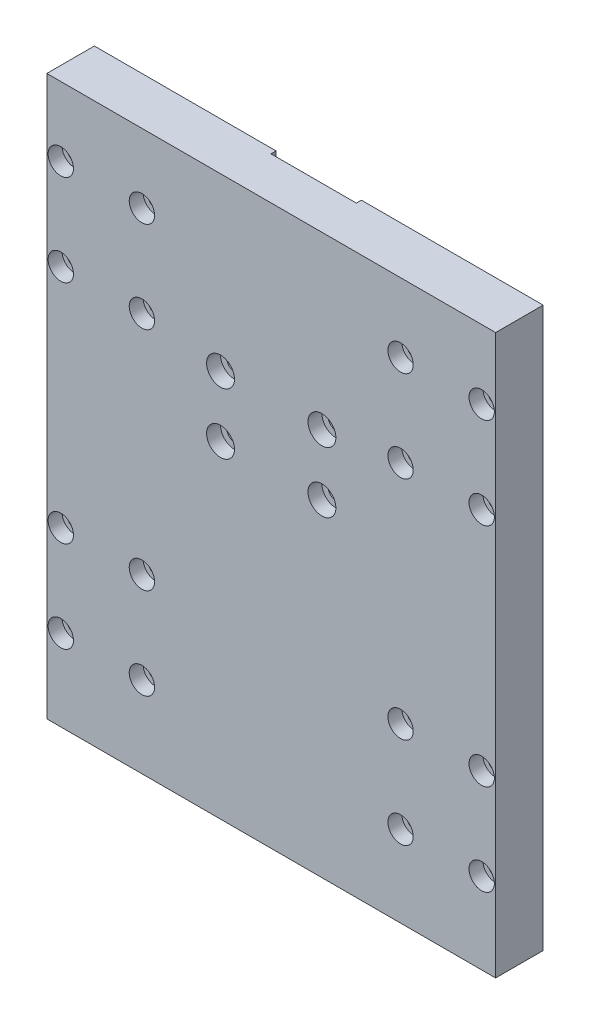
from build123d import *

# Parameters (mm, degrees)
SKETCH1_R                               = 3
BOSS_EXTRUDE1_DEPTH                     = 18.75
SKETCH2_R                               = 5
CUT_EXTRUDE3_DEPTH                      = 5.5
CBORE_FOR_M5_HEX_HEAD_BOLT1_D           = 6
CBORE_FOR_M5_HEX_HEAD_BOLT1_CBORE_D     = 11
CBORE_FOR_M5_HEX_HEAD_BOLT1_CBORE_DEPTH = 5.5
CUT_EXTRUDE4_DEPTH                      = 40
CUT_EXTRUDE5_DEPTH                      = 4


with BuildPart() as part:
    # Sketch1 → Boss-Extrude1 (new body)
    with BuildSketch(Plane.XY):
        Polygon((88.518625365, 66.433253323), (-88.518625365, 66.433253323), (-88.518625365, 46.433253323), (-88.518625365, -4.066746677), (-88.518625365, -154.066746677), (88.518625365, -154.066746677), (88.518625365, -4.066746677), (88.518625365, 46.433253323), align=None)
        with Locations((83.018625365, 39.183253323)):
            Circle(SKETCH1_R, mode=Mode.SUBTRACT)
        with Locations((51.018625365, 39.183253323)):
            Circle(SKETCH1_R, mode=Mode.SUBTRACT)
        with Locations((83.018625365, 3.183253323)):
            Circle(SKETCH1_R, mode=Mode.SUBTRACT)
        with Locations((51.018625365, 3.183253323)):
            Circle(SKETCH1_R, mode=Mode.SUBTRACT)
        with Locations((83.018625365, -86.016746677)):
            Circle(SKETCH1_R, mode=Mode.SUBTRACT)
        with Locations((51.018625365, -86.016746677)):
            Circle(SKETCH1_R, mode=Mode.SUBTRACT)
        with Locations((51.018625365, -122.016746677)):
            Circle(SKETCH1_R, mode=Mode.SUBTRACT)
        with Locations((83.018625365, -122.016746677)):
            Circle(SKETCH1_R, mode=Mode.SUBTRACT)
        with Locations(Location((-83.018625365, -122.016746677, 0), (0, 0, 180))):
            Circle(SKETCH1_R, mode=Mode.SUBTRACT)
        with Locations(Location((-51.018625365, -122.016746677, 0), (0, 0, 180))):
            Circle(SKETCH1_R, mode=Mode.SUBTRACT)
        with Locations(Location((-51.018625365, -86.016746677, 0), (0, 0, 180))):
            Circle(SKETCH1_R, mode=Mode.SUBTRACT)
        with Locations(Location((-83.018625365, -86.016746677, 0), (0, 0, 180))):
            Circle(SKETCH1_R, mode=Mode.SUBTRACT)
        with Locations(Location((-51.018625365, 3.183253323, 0), (0, 0, 180))):
            Circle(SKETCH1_R, mode=Mode.SUBTRACT)
        with Locations(Location((-83.018625365, 3.183253323, 0), (0, 0, 180))):
            Circle(SKETCH1_R, mode=Mode.SUBTRACT)
        with Locations(Location((-51.018625365, 39.183253323, 0), (0, 0, 180))):
            Circle(SKETCH1_R, mode=Mode.SUBTRACT)
        with Locations(Location((-83.018625365, 39.183253323, 0), (0, 0, 180))):
            Circle(SKETCH1_R, mode=Mode.SUBTRACT)
    extrude(amount=BOSS_EXTRUDE1_DEPTH)

    # Sketch2 → Cut-Extrude3 (cut)
    with BuildSketch(Plane.XY.offset(18.75)):
        with Locations((-51.018625365, 39.183253323)):
            Circle(SKETCH2_R)
        with Locations((-83.018625365, 39.183253323)):
            Circle(SKETCH2_R)
        with Locations((-83.018625365, 3.183253323)):
            Circle(SKETCH2_R)
        with Locations((51.018625365, 39.183253323)):
            Circle(SKETCH2_R)
        with Locations((83.018625365, 39.183253323)):
            Circle(SKETCH2_R)
        with Locations((83.018625365, 3.183253323)):
            Circle(SKETCH2_R)
        with Locations((51.018625365, 3.183253323)):
            Circle(SKETCH2_R)
        with Locations((-51.018625365, 3.183253323)):
            Circle(SKETCH2_R)
        with Locations((-83.018625365, -86.016746677)):
            Circle(SKETCH2_R)
        with Locations((-51.018625365, -86.016746677)):
            Circle(SKETCH2_R)
        with Locations((-51.018625365, -122.016746677)):
            Circle(SKETCH2_R)
        with Locations((-83.018625365, -122.016746677)):
            Circle(SKETCH2_R)
        with Locations((51.018625365, -122.016746677)):
            Circle(SKETCH2_R)
        with Locations((51.018625365, -86.016746677)):
            Circle(SKETCH2_R)
        with Locations((83.018625365, -86.016746677)):
            Circle(SKETCH2_R)
        with Locations((83.018625365, -122.016746677)):
            Circle(SKETCH2_R)
    extrude(amount=-CUT_EXTRUDE3_DEPTH, mode=Mode.SUBTRACT)

    # CBORE for M5 Hex Head Bolt1 (through all)
    with Locations(Plane.XY.offset(18.75)):
        with Locations((-20, -1), (20, -1), (-20, -25), (20, -25)):
            CounterBoreHole(CBORE_FOR_M5_HEX_HEAD_BOLT1_D / 2, CBORE_FOR_M5_HEX_HEAD_BOLT1_CBORE_D / 2, CBORE_FOR_M5_HEX_HEAD_BOLT1_CBORE_DEPTH)

    # Sketch7 → Cut-Extrude4 (cut)
    with BuildSketch(Plane(origin=(0, 66.433253323, 0), x_dir=(1, 0, 0), z_dir=(0, 1, 0))):
        Polygon((-14.828427125, -2), (-16.828427125, -2), (-16.828427125, 0), (16.828427125, 0), (16.828427125, -2), (14.828427125, -2), align=None)
    extrude(amount=-CUT_EXTRUDE4_DEPTH, mode=Mode.SUBTRACT)

    # Sketch8 → Cut-Extrude5 (cut)
    with BuildSketch(Plane(origin=(0, 0, 0), x_dir=(-1, 0, 0), z_dir=(0, 0, -1))):
        with BuildLine():
            Line((18.941074346, 17.528523034), (18.941074346, 6.471477064))
            ThreePointArc((18.941074346, 6.471477064), (18.154389929, 5.908425795), (17.361427351, 5.354251227))
            Line((17.361427351, 5.354251227), (-17.361427384, 5.354251227))
            ThreePointArc((-17.361427384, 5.354251227), (-18.154389934, 5.908425774), (-18.941074346, 6.471476988))
            Line((-18.941074346, 6.471476988), (-18.941074346, 17.528522958))
            ThreePointArc((-18.941074346, 17.528522958), (-18.154389929, 18.091574227), (-17.361427351, 18.645748796))
            Line((-17.361427351, 18.645748796), (17.361427384, 18.645748796))
            ThreePointArc((17.361427384, 18.645748796), (18.154389934, 18.091574248), (18.941074346, 17.528523034))
        make_face()
    extrude(amount=-CUT_EXTRUDE5_DEPTH, mode=Mode.SUBTRACT)


solid = part.part
